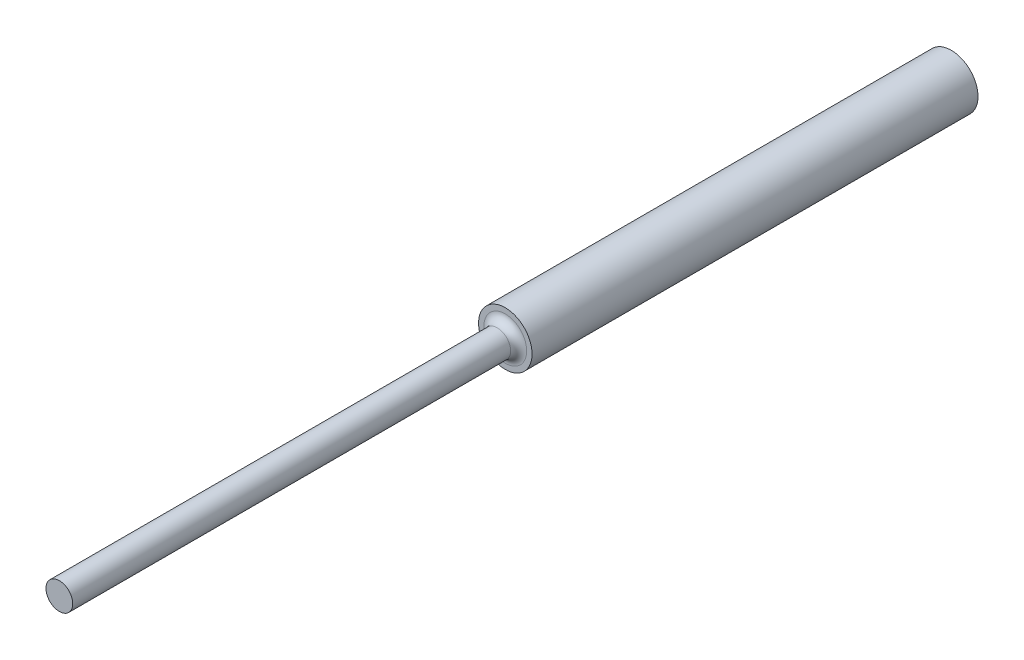
from build123d import *

# Parameters (mm, degrees)
SKETCH1_R           = 30
BOSS_EXTRUDE1_DEPTH = 500
SKETCH2_R           = 15
BOSS_EXTRUDE2_DEPTH = 500
FILLET3_R           = 9


with BuildPart() as part:
    # Sketch1 → Boss-Extrude1 (new body)
    with BuildSketch(Plane.XY):
        Circle(SKETCH1_R)
    extrude(amount=BOSS_EXTRUDE1_DEPTH)

    # Sketch2 → Boss-Extrude2 (add)
    with BuildSketch(Plane.XY.offset(500)):
        Circle(SKETCH2_R)
    extrude(amount=BOSS_EXTRUDE2_DEPTH)

    # Fillet3
    fillet3_edges = [part.edges().sort_by_distance(p)[0] for p in [
        (-15, 0, 500),
    ]]
    fillet(fillet3_edges, radius=FILLET3_R)


solid = part.part
